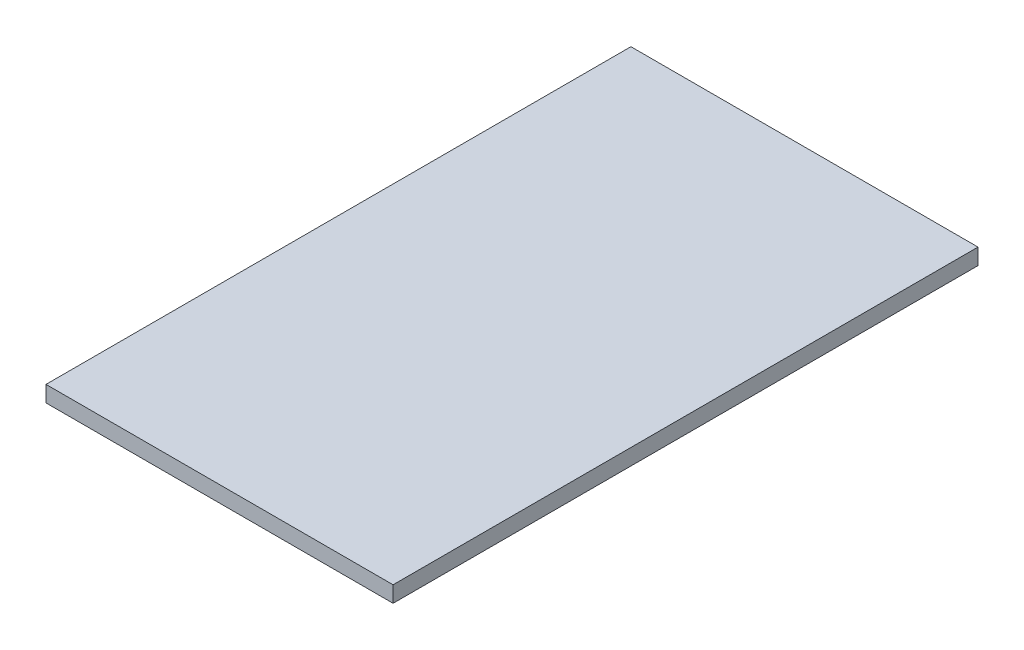
from build123d import *

# Parameters (mm, degrees)
SKETCH1_W           = 54
SKETCH1_H           = 91
BOSS_EXTRUDE1_DEPTH = 2.5


with BuildPart() as part:
    # Sketch1 → Boss-Extrude1 (new body)
    with BuildSketch(Plane(origin=(0, 0, 0), x_dir=(1, 0, 0), z_dir=(0, 1, 0))):
        Rectangle(SKETCH1_W, SKETCH1_H)
    extrude(amount=BOSS_EXTRUDE1_DEPTH)


solid = part.part
